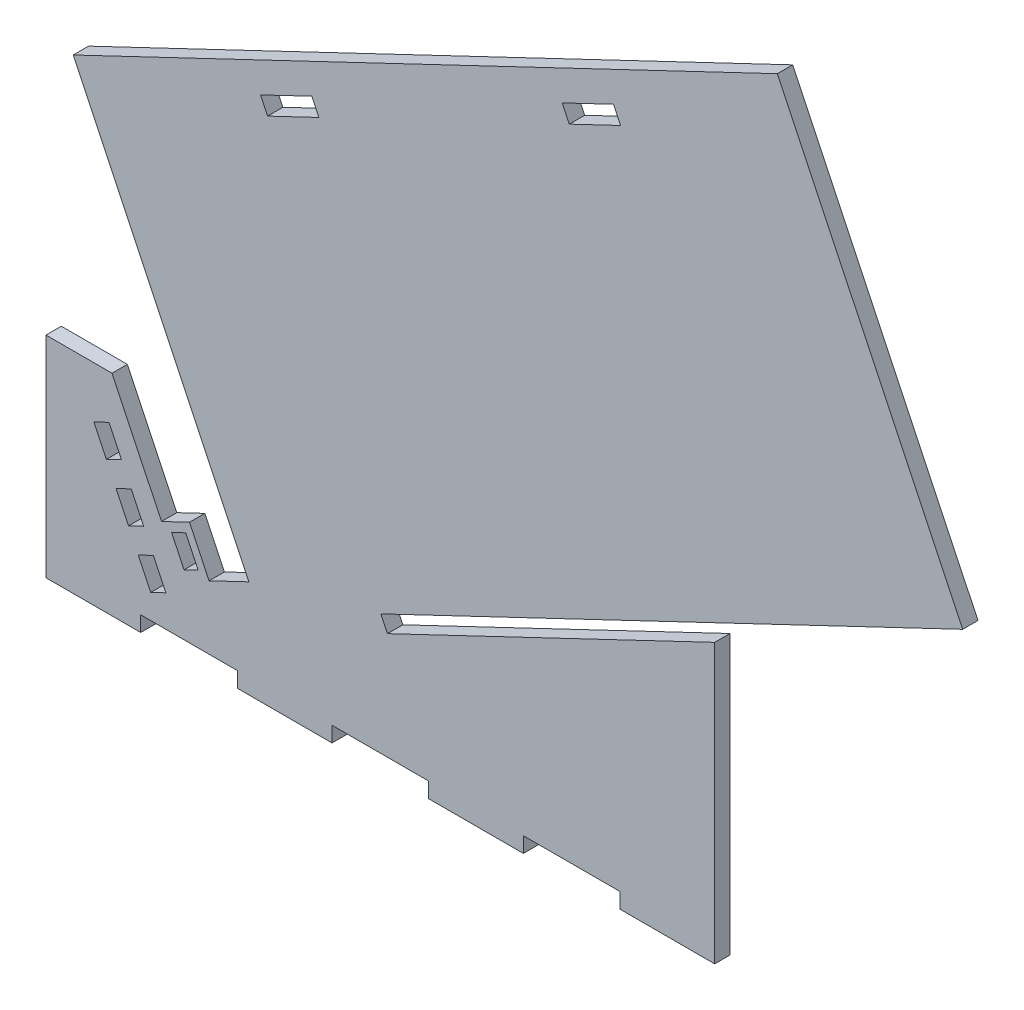
from build123d import *

# Parameters (mm, degrees)
BOSS_EXTRUDE1_DEPTH = 5.5


with BuildPart() as part:
    # Sketch1 → Boss-Extrude1 (new body)
    with BuildSketch(Plane.XY):
        Polygon((-264.257200354, -90.158072964), (-264.257200354, -95.658072964), (-230.257200354, -95.658072964), (-230.257200354, -90.158072964), (-195.597200354, -90.158072964), (-195.597200354, -95.658072964), (-161.597200354, -95.658072964), (-161.597200354, -90.158072964), (-126.917200354, -90.158072964), (-126.917200354, -95.658072964), (-92.917200354, -95.658072964), (-92.917200354, -90.158072964), (-58.257200354, -90.158072964), (-58.257200354, -95.658072964), (-24.257200354, -95.658072964), (-24.257200354, -90.158072964), (-24.257200354, 4.28308251), (-141.707906421, -51.738030582), (-144.075717453, -46.773811518), (64.743830776, 52.828003736), (-1.770133681, 192.277430168), (-254.494013299, 71.734323062), (-191.424137459, -60.49442102), (-205.726515812, -67.316305554), (-212.73562074, -52.621411895), (-222.803045061, -57.423326974), (-240.553810667, -20.208072964), (-264.257200354, -20.208072964), align=None)
        Polygon((-226.65672616, -81.398839397), (-231.134041567, -72.01195244), (-225.718529861, -69.428885859), (-221.241214454, -78.815772816), align=None, mode=Mode.SUBTRACT)
        Polygon((-214.729005488, -68.418450138), (-219.206320895, -59.031563181), (-214.151843303, -56.620701038), (-209.674527896, -66.007587996), align=None, mode=Mode.SUBTRACT)
        Polygon((-233.682985152, -52.731058098), (-229.205669745, -62.117945056), (-234.621181451, -64.701011637), (-239.098496858, -55.314124679), align=None, mode=Mode.SUBTRACT)
        Polygon((-241.647440443, -36.033230338), (-237.170125036, -45.420117295), (-242.585636742, -48.003183876), (-247.062952149, -38.616296919), align=None, mode=Mode.SUBTRACT)
        Polygon((-168.861811902, 101.721088208), (-166.321796431, 96.39583503), (-184.734536232, 87.613408655), (-187.274551703, 92.938661833), align=None, mode=Mode.SUBTRACT)
        Polygon((-60.55157778, 153.382419825), (-58.011562309, 148.057166647), (-76.42430211, 139.274740272), (-78.964317581, 144.59999345), align=None, mode=Mode.SUBTRACT)
    extrude(amount=BOSS_EXTRUDE1_DEPTH)


solid = part.part
